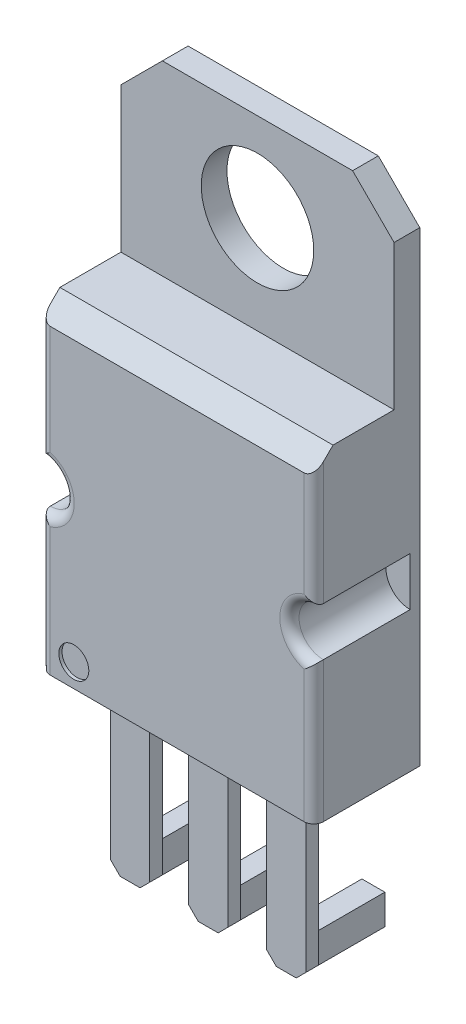
from build123d import *

# Parameters (mm, degrees)
CROQUIS1_W              = 8.5
CROQUIS1_H              = 10
SALIENTE_EXTRUIR1_DEPTH = 3.3
CROQUIS2_R              = 0.466725864
CORTAR_EXTRUIR1_DEPTH   = 0.1
CORTAR_EXTRUIR2_DEPTH   = 3
CORTAR_EXTRUIR3_DEPTH   = 3
CHAFL_N1_SIZE           = 0.6
REDONDEO1_R             = 0.3
CROQUIS5_W              = 8.5
CROQUIS5_H              = 0.8
SALIENTE_EXTRUIR2_DEPTH = 5.8
CROQUIS6_R              = 1.750484279
CORTAR_EXTRUIR4_DEPTH   = 5.8
CROQUIS7_W              = 1.22
CROQUIS7_H              = 0.3917794
SALIENTE_EXTRUIR3_DEPTH = 5.3
CROQUIS8_W              = 1.22
CROQUIS8_H              = 0.3917794
SALIENTE_EXTRUIR4_DEPTH = 5.3
CROQUIS9_W              = 0.675717965
CROQUIS9_H              = 1
CROQUIS9_W_2            = 0.619737604
CROQUIS9_W_3            = 0.713804918
SALIENTE_EXTRUIR5_DEPTH = 2.3
CHAFL_N2_SIZE           = 0.3
CHAFL_N3_SIZE           = 0.3
CHAFL_N4_SIZE           = 0.3
CHAFL_N5_SIZE           = 0.3
CHAFL_N6_SIZE           = 0.3
CHAFL_N7_SIZE           = 0.3
CHAFL_N8_SIZE           = 1.29
CHAFL_N9_SIZE           = 1.29


with BuildPart() as part:
    # Croquis1 → Saliente-Extruir1 (new body)
    with BuildSketch(Plane.XY):
        Rectangle(CROQUIS1_W, CROQUIS1_H)
    extrude(amount=SALIENTE_EXTRUIR1_DEPTH)

    # Croquis2 → Cortar-Extruir1 (cut)
    with BuildSketch(Plane.XY.offset(3.3)):
        with Locations((-3.215855375, -4.280210789)):
            Circle(CROQUIS2_R)
    extrude(amount=-CORTAR_EXTRUIR1_DEPTH, mode=Mode.SUBTRACT)

    # Croquis3 → Cortar-Extruir2 (cut)
    with BuildSketch(Plane.XY.offset(3.3)):
        with BuildLine():
            Line((-4.25, 0.746438526), (-4.25, -0.746438526))
            ThreePointArc((-4.25, -0.746438526), (-3.503561474, 0), (-4.25, 0.746438526))
        make_face()
    extrude(amount=-CORTAR_EXTRUIR2_DEPTH, mode=Mode.SUBTRACT)

    # Croquis4 → Cortar-Extruir3 (cut)
    with BuildSketch(Plane.XY.offset(3.3)):
        with BuildLine():
            Line((4.25, 0.878718771), (4.25, -0.633055459))
            ThreePointArc((4.25, -0.633055459), (3.494112885, 0.122831656), (4.25, 0.878718771))
        make_face()
    extrude(amount=-CORTAR_EXTRUIR3_DEPTH, mode=Mode.SUBTRACT)

    # Chaflán1
    chafl_n1_edges = [part.edges().sort_by_distance(p)[0] for p in [
        (0, 5, 3.3),
    ]]
    chamfer(chafl_n1_edges, length=CHAFL_N1_SIZE)

    # Redondeo1
    redondeo1_edges = [part.edges().sort_by_distance(p)[0] for p in [
        (4.25, -2.816527729, 3.3),
        (-4.25, -2.873219263, 3.3),
        (-3.503561474, 0, 3.3),
        (4.25, 2.639359386, 3.3),
        (3.494112885, 0.122831656, 3.3),
        (-4.25, 2.573219263, 3.3),
    ]]
    fillet(redondeo1_edges, radius=REDONDEO1_R)

    # Croquis5 → Saliente-Extruir2 (add)
    with BuildSketch(Plane(origin=(0, 5, 0), x_dir=(1, 0, 0), z_dir=(0, 1, 0))):
        with Locations((0, -0.4)):
            Rectangle(CROQUIS5_W, CROQUIS5_H)
    extrude(amount=SALIENTE_EXTRUIR2_DEPTH)

    # Croquis6 → Cortar-Extruir4 (cut)
    with BuildSketch(Plane.XY.offset(0.8)):
        with Locations((0, 8.041970686)):
            Circle(CROQUIS6_R)
    extrude(amount=-CORTAR_EXTRUIR4_DEPTH, mode=Mode.SUBTRACT)

    # Croquis7 → Saliente-Extruir3 (add)
    with BuildSketch(Plane.XZ.offset(5)):
        with Locations((0, 2.138324213)):
            Rectangle(CROQUIS7_W, CROQUIS7_H)
    extrude(amount=SALIENTE_EXTRUIR3_DEPTH)

    # Croquis8 → Saliente-Extruir4 (add)
    with BuildSketch(Plane.XZ.offset(5)):
        with Locations((2.43, 2.138324213)):
            Rectangle(CROQUIS8_W, CROQUIS8_H)
        with Locations((-2.43, 2.138324213)):
            Rectangle(CROQUIS8_W, CROQUIS8_H)
    extrude(amount=SALIENTE_EXTRUIR4_DEPTH)

    # Croquis9 → Saliente-Extruir5 (add)
    with BuildSketch(Plane(origin=(0, 0, 1.942434513), x_dir=(-1, 0, 0), z_dir=(0, 0, -1))):
        with Locations((-0.032858983, -9.8)):
            Rectangle(CROQUIS9_W, CROQUIS9_H)
        with Locations((2.407034508, -9.8)):
            Rectangle(CROQUIS9_W_2, CROQUIS9_H)
        with Locations((-2.448498949, -9.8)):
            Rectangle(CROQUIS9_W_3, CROQUIS9_H)
    extrude(amount=SALIENTE_EXTRUIR5_DEPTH)

    # Chaflán2
    chafl_n2_edges = [part.edges().sort_by_distance(p)[0] for p in [
        (3.04, -10.3, 2.138324213),
    ]]
    chamfer(chafl_n2_edges, length=CHAFL_N2_SIZE)

    # Chaflán3
    chafl_n3_edges = [part.edges().sort_by_distance(p)[0] for p in [
        (1.82, -10.3, 2.138324213),
    ]]
    chamfer(chafl_n3_edges, length=CHAFL_N3_SIZE)

    # Chaflán4
    chafl_n4_edges = [part.edges().sort_by_distance(p)[0] for p in [
        (-0.61, -10.3, 2.138324213),
    ]]
    chamfer(chafl_n4_edges, length=CHAFL_N4_SIZE)

    # Chaflán5
    chafl_n5_edges = [part.edges().sort_by_distance(p)[0] for p in [
        (-3.04, -10.3, 2.138324213),
    ]]
    chamfer(chafl_n5_edges, length=CHAFL_N5_SIZE)

    # Chaflán6
    chafl_n6_edges = [part.edges().sort_by_distance(p)[0] for p in [
        (-1.82, -10.3, 2.138324213),
    ]]
    chamfer(chafl_n6_edges, length=CHAFL_N6_SIZE)

    # Chaflán7
    chafl_n7_edges = [part.edges().sort_by_distance(p)[0] for p in [
        (0.61, -10.3, 2.138324213),
    ]]
    chamfer(chafl_n7_edges, length=CHAFL_N7_SIZE)

    # Chaflán8
    chafl_n8_edges = [part.edges().sort_by_distance(p)[0] for p in [
        (4.25, 10.8, 0.4),
    ]]
    chamfer(chafl_n8_edges, length=CHAFL_N8_SIZE)

    # Chaflán9
    chafl_n9_edges = [part.edges().sort_by_distance(p)[0] for p in [
        (-4.25, 10.8, 0.4),
    ]]
    chamfer(chafl_n9_edges, length=CHAFL_N9_SIZE)


solid = part.part
